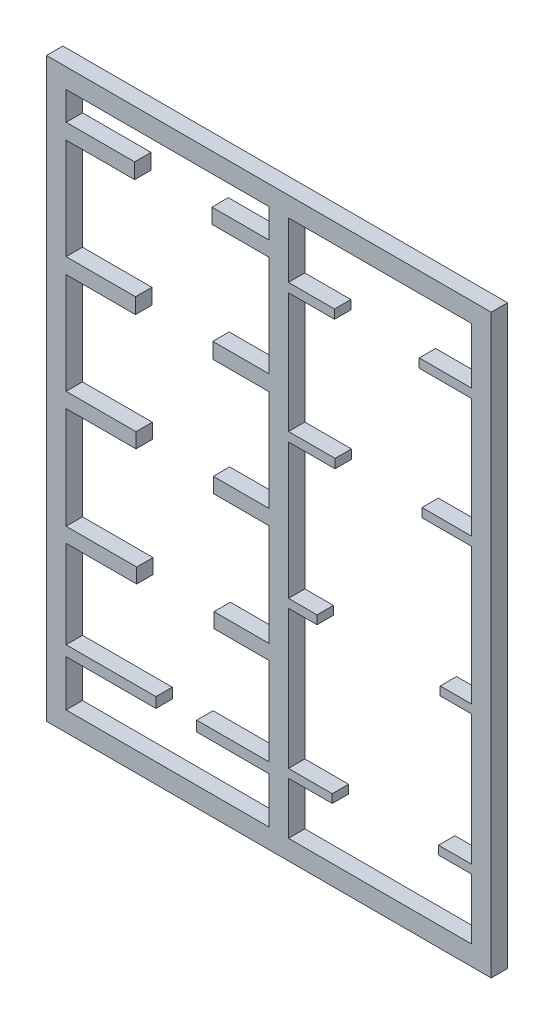
from build123d import *

# Parameters (mm, degrees)
SKETCH1_W           = 69.025336674
SKETCH1_H           = 89.501461159
SKETCH1_W_2         = 62.929336674
SKETCH1_H_2         = 83.405461159
SKETCH1_W_3         = 10.637877579
SKETCH1_H_3         = 2.400289179
SKETCH1_W_4         = 10.76808562
SKETCH1_H_4         = 2.410116194
SKETCH1_W_5         = 10.845055727
SKETCH1_H_5         = 2.320385117
SKETCH1_W_6         = 8.61961261
SKETCH1_W_7         = 8.696582717
SKETCH1_W_8         = 7.233122671
SKETCH1_H_6         = 1.406184517
SKETCH1_W_9         = 7.693154637
SKETCH1_H_7         = 1.374601098
SKETCH1_W_10        = 4.85814416
SKETCH1_H_8         = 1.33271236
SKETCH1_W_11        = 5.120398278
SKETCH1_H_9         = 1.332092237
SKETCH1_W_12        = 6.797362186
SKETCH1_H_10        = 1.320409981
SKETCH1_W_13        = 10.954732913
SKETCH1_H_11        = 2.291459462
SKETCH1_W_14        = 13.940499857
SKETCH1_H_12        = 1.597280353
SKETCH1_W_15        = 11.193978309
SKETCH1_W_16        = 8.509935424
SKETCH1_W_17        = 8.826790758
SKETCH1_H_13        = 2.316503995
SKETCH1_W_18        = 8.117773256
SKETCH1_H_14        = 1.391011178
SKETCH1_W_19        = 7.14925004
SKETCH1_W_20        = 4.435758543
BOSS_EXTRUDE1_DEPTH = 2.54


with BuildPart() as part:
    # Sketch1 → Boss-Extrude1 (new body)
    # profile 1 of 20: a face of its own
    with BuildSketch(Plane.XY):
        with Locations((-59.696453639, 17.511447337)):
            Rectangle(SKETCH1_W, SKETCH1_H)
        with Locations((-59.696453639, 17.511447337)):
            Rectangle(SKETCH1_W_2, SKETCH1_H_2, mode=Mode.SUBTRACT)
    # profile 2 of 20: a face of its own
    with BuildSketch(Plane.XY):
        with Locations((-85.842183186, 53.603021221)):
            Rectangle(SKETCH1_W_3, SKETCH1_H_3)
    # profile 3 of 20: a face of its own
    with BuildSketch(Plane.XY):
        with Locations((-85.777079166, 35.533767551)):
            Rectangle(SKETCH1_W_4, SKETCH1_H_4)
    # profile 4 of 20: a face of its own
    with BuildSketch(Plane.XY):
        with Locations((-85.738594113, 17.477618848)):
            Rectangle(SKETCH1_W_5, SKETCH1_H_5)
    # profile 5 of 20: a face of its own
    with BuildSketch(Plane.XY):
        with Locations((-64.006259944, 17.477618848)):
            Rectangle(SKETCH1_W_6, SKETCH1_H_5)
    # profile 6 of 20: a face of its own
    with BuildSketch(Plane.XY):
        with Locations((-64.044744998, 35.533767551)):
            Rectangle(SKETCH1_W_7, SKETCH1_H_4)
    # profile 7 of 20: a face of its own
    with BuildSketch(Plane.XY):
        Polygon((-56.648453639, 59.214177916), (-59.696453639, 59.214177916), (-59.696453639, 54.719380626), (-59.696453639, 52.402876631), (-59.696453639, 36.738825648), (-59.696453639, 34.328709454), (-59.696453639, 18.637811406), (-59.696453639, 16.317426289), (-59.696453639, 0.495724739), (-59.696453639, -1.795734723), (-59.696453639, -15.430210162), (-59.696453639, -17.027490515), (-59.696453639, -24.191283243), (-56.648453639, -24.191283243), (-56.648453639, -16.118247947), (-56.648453639, -14.797837966), (-56.648453639, 6.731660618), (-56.648453639, 8.064372978), (-56.648453639, 29.090462814), (-56.648453639, 30.496647331), (-56.648453639, 49.145727963), (-56.648453639, 50.536739141), align=None)
    # profile 8 of 20: a face of its own
    with BuildSketch(Plane.XY):
        with Locations((-53.031892304, 29.793555073)):
            Rectangle(SKETCH1_W_8, SKETCH1_H_6)
    # profile 9 of 20: a face of its own
    with BuildSketch(Plane.XY):
        with Locations((-32.078362621, 29.946844808)):
            Rectangle(SKETCH1_W_9, SKETCH1_H_7)
    # profile 10 of 20: a face of its own
    with BuildSketch(Plane.XY):
        with Locations((-30.660857382, 7.398016798)):
            Rectangle(SKETCH1_W_10, SKETCH1_H_8)
    # profile 11 of 20: a face of its own
    with BuildSketch(Plane.XY):
        with Locations((-30.791984441, -14.131791848)):
            Rectangle(SKETCH1_W_11, SKETCH1_H_9)
    # profile 12 of 20: a face of its own
    with BuildSketch(Plane.XY):
        with Locations((-53.249772546, -15.458042957)):
            Rectangle(SKETCH1_W_12, SKETCH1_H_10)
    # profile 13 of 20: a face of its own
    with BuildSketch(Plane.XY):
        with Locations((-85.68375552, -0.650004992)):
            Rectangle(SKETCH1_W_13, SKETCH1_H_11)
    # profile 14 of 20: a face of its own
    with BuildSketch(Plane.XY):
        with Locations((-84.190872047, -16.228850339)):
            Rectangle(SKETCH1_W_14, SKETCH1_H_12)
    # profile 15 of 20: a face of its own
    with BuildSketch(Plane.XY):
        with Locations((-65.293442794, -16.228850339)):
            Rectangle(SKETCH1_W_15, SKETCH1_H_12)
    # profile 16 of 20: a face of its own
    with BuildSketch(Plane.XY):
        with Locations((-63.951421351, -0.650004992)):
            Rectangle(SKETCH1_W_16, SKETCH1_H_11)
    # profile 17 of 20: a face of its own
    with BuildSketch(Plane.XY):
        with Locations((-64.109849018, 53.561128629)):
            Rectangle(SKETCH1_W_17, SKETCH1_H_13)
    # profile 18 of 20: a face of its own
    with BuildSketch(Plane.XY):
        with Locations((-32.29067193, 49.841233552)):
            Rectangle(SKETCH1_W_18, SKETCH1_H_14)
    # profile 19 of 20: a face of its own
    with BuildSketch(Plane.XY):
        with Locations((-53.073828619, 49.841233552)):
            Rectangle(SKETCH1_W_19, SKETCH1_H_14)
    # profile 20 of 20: a face of its own
    with BuildSketch(Plane.XY):
        with Locations((-54.430574368, 7.398016798)):
            Rectangle(SKETCH1_W_20, SKETCH1_H_8)
    extrude(amount=BOSS_EXTRUDE1_DEPTH)


solid = part.part
